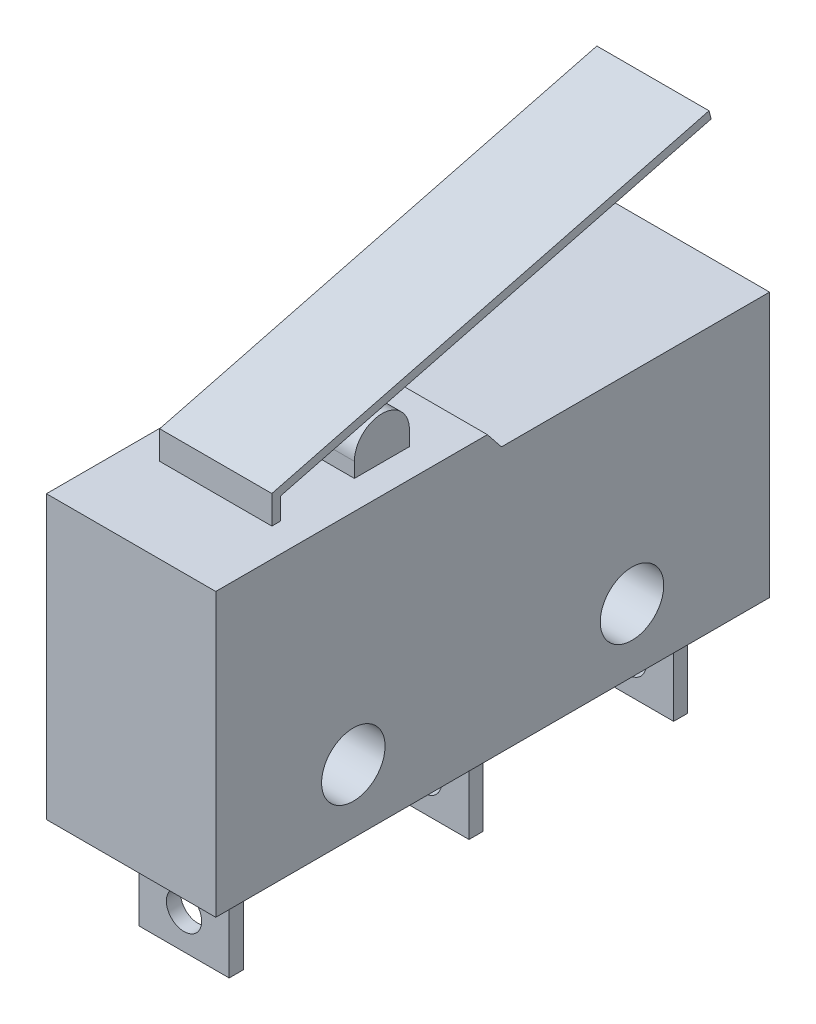
from build123d import *

# Parameters (mm, degrees)
SKETCH1_R         = 1.143
MAINBODY_DEPTH    = 6.096
SKETCH2_OUTSIDE_W = 13.71
SKETCH2_OUTSIDE_H = 26.41
SKETCH2_OUTSIDE_R = 0.635
SIDETRIM_DEPTH    = 19.939


with BuildPart() as part:
    # Sketch1 → MainBody (new body)
    with BuildSketch(Plane(origin=(0, 0, 0), x_dir=(0, 0, -1), z_dir=(1, 0, 0))):
        with BuildLine():
            Line((0, 0), (0, 10.16))
            Line((0, 10.16), (3.048, 10.16))
            Line((3.048, 10.16), (3.048, 11.176))
            Line((3.048, 11.176), (18.787804319, 15.24))
            Line((18.787804319, 15.24), (18.864004319, 14.944878669))
            Line((18.864004319, 14.944878669), (3.3528, 10.939902935))
            Line((3.3528, 10.939902935), (3.3528, 10.16))
            Line((3.3528, 10.16), (6.0198, 10.16))
            Line((6.0198, 10.16), (6.0198, 10.6934))
            ThreePointArc((6.0198, 10.6934), (7.0104, 11.684), (8.001, 10.6934))
            Line((8.001, 10.6934), (8.001, 10.16))
            Line((8.001, 10.16), (9.779, 10.16))
            Line((9.779, 10.16), (10.287, 9.525))
            Line((10.287, 9.525), (19.939, 9.525))
            Line((19.939, 9.525), (19.939, 0))
            Line((19.939, 0), (18.415, 0))
            Line((18.415, 0), (18.415, -3.556))
            Line((18.415, -3.556), (17.907, -3.556))
            Line((17.907, -3.556), (17.907, 0))
            Line((17.907, 0), (11.049, 0))
            Line((11.049, 0), (11.049, -3.556))
            Line((11.049, -3.556), (10.541, -3.556))
            Line((10.541, -3.556), (10.541, 0))
            Line((10.541, 0), (2.413, 0))
            Line((2.413, 0), (2.413, -3.556))
            Line((2.413, -3.556), (1.905, -3.556))
            Line((1.905, -3.556), (1.905, 0))
            Line((1.905, 0), (0, 0))
        make_face()
        with Locations(Location((4.953, 2.286, 0), (0, 0, 180))):
            Circle(SKETCH1_R, mode=Mode.SUBTRACT)
        with Locations(Location((14.986, 2.286, 0), (0, 0, 180))):
            Circle(SKETCH1_R, mode=Mode.SUBTRACT)
    extrude(amount=MAINBODY_DEPTH)

    # Sketch2 outside → SideTrim (cut)
    # profile 1 of 2: a face of its own
    with BuildSketch(Plane.XY):
        with Locations((3.048, 5.842)):
            Rectangle(SKETCH2_OUTSIDE_W, SKETCH2_OUTSIDE_H)
        Polygon((0, 10.16), (1.0287, 10.16), (1.0287, 15.24), (5.0673, 15.24), (5.0673, 10.16), (6.096, 10.16), (6.096, 0), (4.6736, 0), (4.6736, -3.556), (1.4224, -3.556), (1.4224, 0), (0, 0), align=None, mode=Mode.SUBTRACT)
    # profile 2 of 2: a face of its own
    with BuildSketch(Plane.XY):
        with Locations(Location((3.048, -2.286, 0), (0, 0, 270))):
            Circle(SKETCH2_OUTSIDE_R)
    extrude(amount=-SIDETRIM_DEPTH, mode=Mode.SUBTRACT)


solid = part.part
